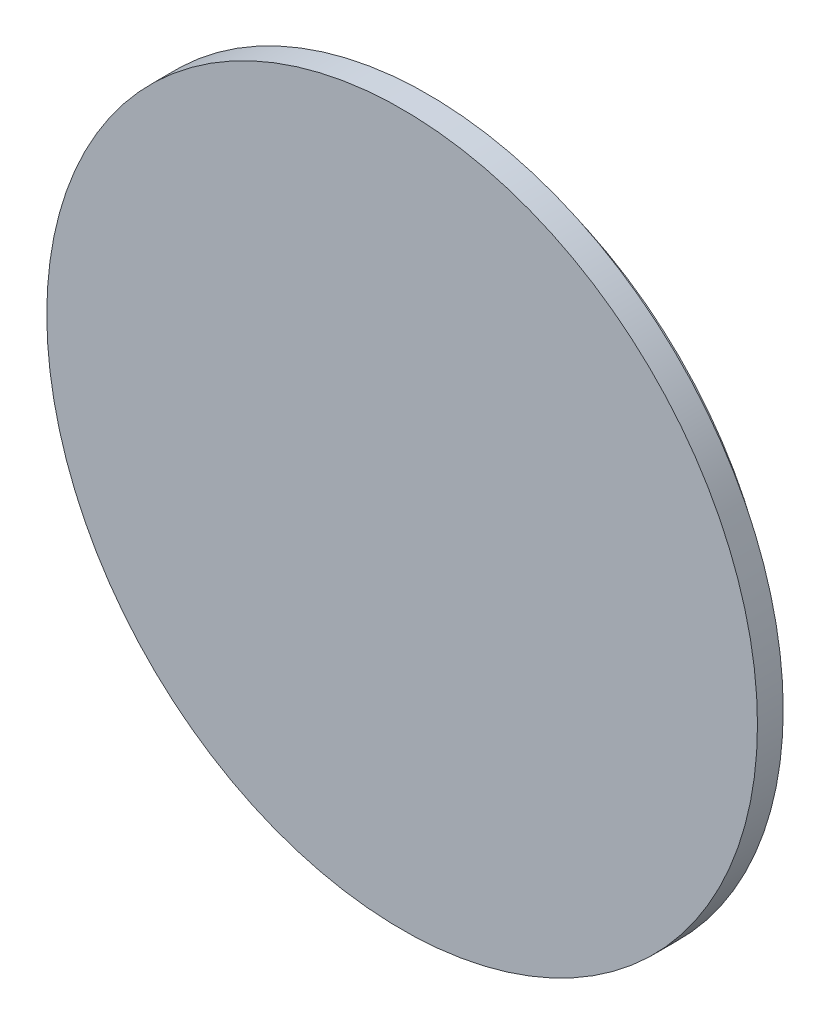
from build123d import *

# Parameters (mm, degrees)
SKETCH1_R               = 34.5
BOSS_EXTRUDE1_DEPTH     = 4.5
SKETCH2_W               = 2.65
SKETCH2_H               = 2
CUT_EXTRUDE1_DEPTH      = 49.997448913
CUT_EXTRUDE1_DEPTH_BACK = 49.997448913
SKETCH4_W               = 1.55
SKETCH4_H               = 1.5
SKETCH6_W               = 1.5
SKETCH6_H               = 1.55
CUT_EXTRUDE2_DEPTH      = 49.997448913


with BuildPart() as part:
    # Sketch1 → Boss-Extrude1 (new body)
    with BuildSketch(Plane.XY):
        Circle(SKETCH1_R)
    extrude(amount=BOSS_EXTRUDE1_DEPTH)

    # Sketch2 → Cut-Revolve1 (revolve, cut)
    with BuildSketch(Plane(origin=(0, 0, 0), x_dir=(1, 0, 0), z_dir=(0, 1, 0)), mode=Mode.PRIVATE) as cut_revolve1_sk:
        with Locations((33.175, -1)):
            Rectangle(SKETCH2_W, SKETCH2_H)
    revolve(cut_revolve1_sk.sketch.rotate(Axis((0, 0, 0), (0, 0, 1)), 180), axis=Axis((0, 0, 0), (0, 0, 1)), mode=Mode.SUBTRACT)

    # Sketch4 → Cut-Extrude1 (cut, two sides: drawn at the far end of the back side and taken through both)
    with BuildSketch(Plane(origin=(0, 0, 0), x_dir=(1, 0, 0), z_dir=(0, 1, 0)).offset(-CUT_EXTRUDE1_DEPTH_BACK)):
        with Locations((0, -0.75)):
            Rectangle(SKETCH4_W, SKETCH4_H)
    extrude(amount=CUT_EXTRUDE1_DEPTH + CUT_EXTRUDE1_DEPTH_BACK, mode=Mode.SUBTRACT)

    # Sketch6 → Cut-Extrude2 (cut, through all)
    with BuildSketch(Plane(origin=(0, 0, 0), x_dir=(0, 0, -1), z_dir=(1, 0, 0))):
        with Locations((-0.75, 0)):
            Rectangle(SKETCH6_W, SKETCH6_H)
    extrude(amount=-CUT_EXTRUDE2_DEPTH, mode=Mode.SUBTRACT)


solid = part.part
